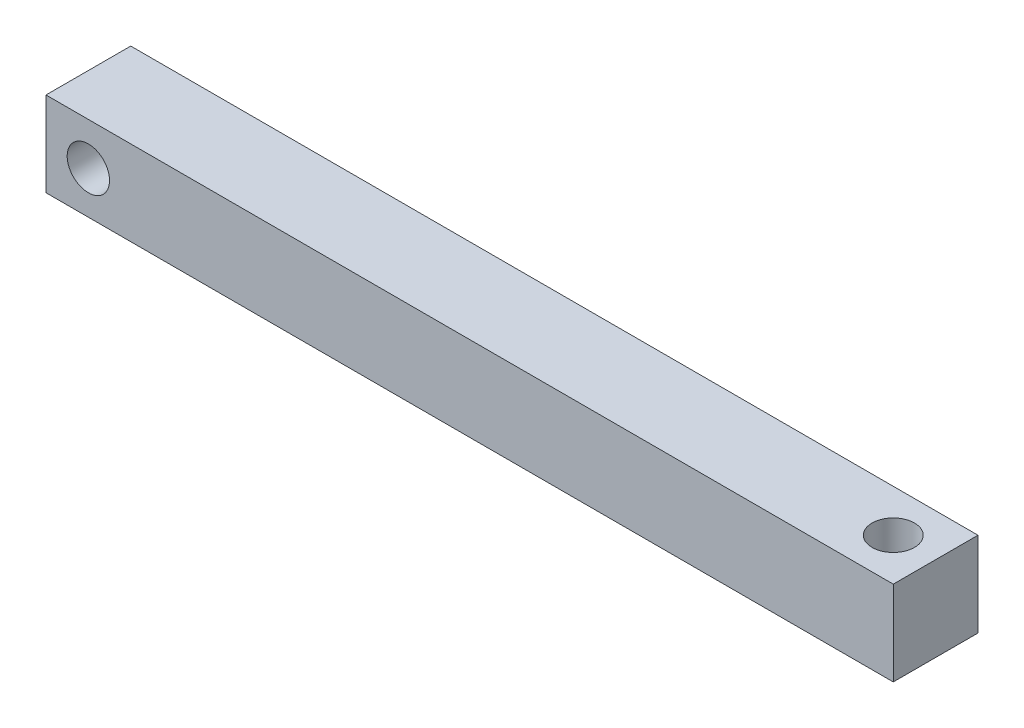
from build123d import *

# Parameters (mm, degrees)
SKETCH1_W           = 200
SKETCH1_H           = 20
BOSS_EXTRUDE2_DEPTH = 20
SKETCH3_R           = 5
CUT_EXTRUDE1_DEPTH  = 103.46950766
SKETCH4_R           = 5
CUT_EXTRUDE2_DEPTH  = 104.923048454


with BuildPart() as part:
    # Sketch1 → Boss-Extrude2 (new body)
    with BuildSketch(Plane.XY):
        Rectangle(SKETCH1_W, SKETCH1_H)
    extrude(amount=BOSS_EXTRUDE2_DEPTH)

    # Sketch3 → Cut-Extrude1 (cut, through all)
    with BuildSketch(Plane.XY.offset(20)):
        with Locations((-90, 0)):
            Circle(SKETCH3_R)
    extrude(amount=-CUT_EXTRUDE1_DEPTH, mode=Mode.SUBTRACT)

    # Sketch4 → Cut-Extrude2 (cut, through all)
    with BuildSketch(Plane.XZ.offset(10)):
        with Locations(Location((90, 10, 0), (0, 0, 270))):
            Circle(SKETCH4_R)
    extrude(amount=-CUT_EXTRUDE2_DEPTH, mode=Mode.SUBTRACT)


solid = part.part
